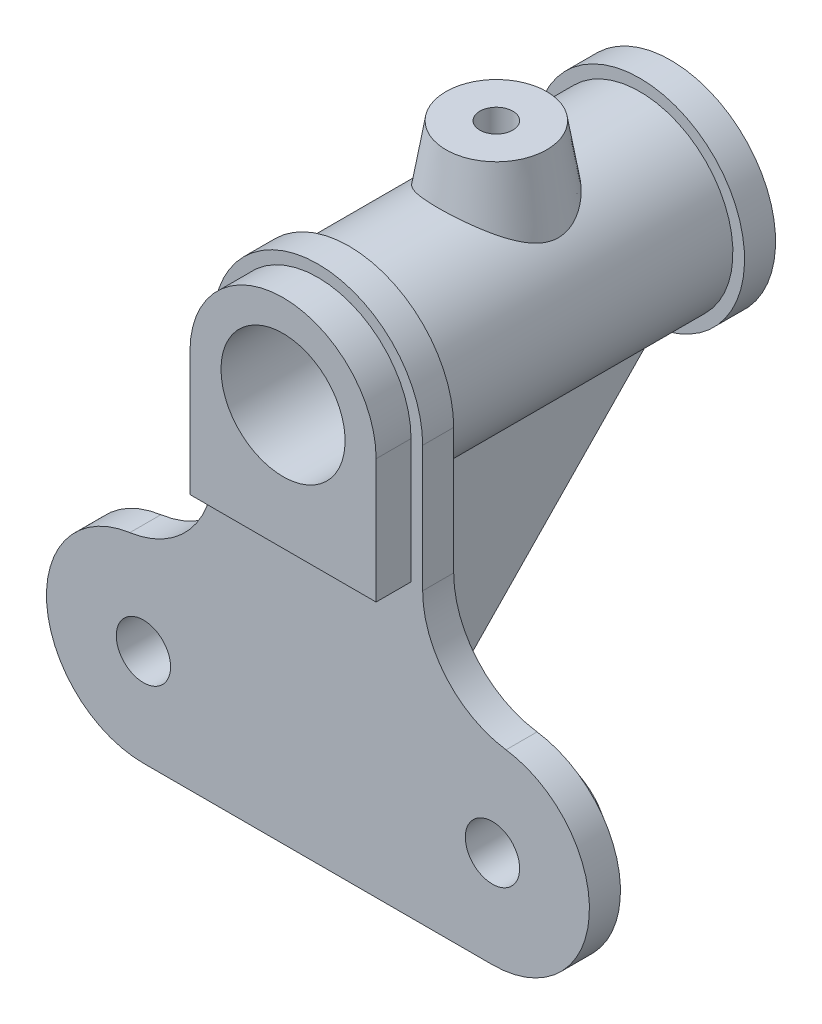
from build123d import *
from build123d.topology import SkipClean

# Parameters (mm, degrees)
SKETCH_1_R               = 7
EXTRUDE_1_DEPTH          = 8
FILLET_1_R               = 25
EXTRUDE_2_DEPTH          = 9
EXTRUDE_START            = 75
SKETCH_3_R               = 24
EXTRUDE_3_DEPTH          = 75
EXTRUDE_START_2          = 8
SKETCH_4_R               = 27
EXTRUDE_4_DEPTH          = 8
SKETCH_5_R               = 7
EXTRUDE_5_DEPTH          = 8
RIB_1_REACH              = 155.851
SKETCH_6_WALL_W          = 405.87807426
SKETCH_6_WALL_H          = 8
SKETCH_8_R               = 16
CUT_EXTRUDE_1_DEPTH      = 170.776323548
HOLE_WIZARD_M10_1_REACH  = 181.549
HOLE_WIZARD_M10_1_BORE_R = 4.25


with BuildPart() as part:
    # 草图1 → 凸台-拉伸1 (new body)
    with BuildSketch(Plane.XY):
        with BuildLine():
            Line((-45, -25), (45, -25))
            ThreePointArc((45, -25), (70, 0), (45, 25))
            Line((45, 25), (27, 25))
            Line((27, 25), (27, 82))
            ThreePointArc((27, 82), (0, 109), (-27, 82))
            Line((-27, 82), (-27, 25))
            Line((-27, 25), (-45, 25))
            ThreePointArc((-45, 25), (-70, 0), (-45, -25))
        make_face()
        with Locations((-45, 0)):
            Circle(SKETCH_1_R, mode=Mode.SUBTRACT)
        with Locations((45, 0)):
            Circle(SKETCH_1_R, mode=Mode.SUBTRACT)
    extrude(amount=EXTRUDE_1_DEPTH)

    # 圆角1
    fillet_1_edges = [part.edges().sort_by_distance(p)[0] for p in [
        (-27, 25, 4),
        (27, 25, 4),
    ]]
    fillet(fillet_1_edges, radius=FILLET_1_R)

    # 草图2 → 凸台-拉伸2 (add)
    with BuildSketch(Plane.XY.offset(8)):
        with BuildLine():
            Line((-24, 82), (-24, 50))
            Line((-24, 50), (24, 50))
            Line((24, 50), (24, 82))
            ThreePointArc((24, 82), (0, 106), (-24, 82))
        make_face()
    extrude(amount=EXTRUDE_2_DEPTH)

    # 草图3 → 凸台-拉伸3 (add)
    with BuildSketch(Plane(origin=(0, 0, 0), x_dir=(-1, 0, 0), z_dir=(0, 0, -1)).offset(EXTRUDE_START)):
        with Locations(Location((0, 82, 0), (0, 0, 180))):
            Circle(SKETCH_3_R)
    extrude(amount=-EXTRUDE_3_DEPTH)

    # 草图4 → 凸台-拉伸4 (add)
    with BuildSketch(Plane(origin=(0, 0, -75), x_dir=(-1, 0, 0), z_dir=(0, 0, -1)).offset(EXTRUDE_START_2)):
        with Locations((0, 82)):
            Circle(SKETCH_4_R)
    extrude(amount=-EXTRUDE_4_DEPTH)

    # 草图5 → 凸台-拉伸5 (add)
    with SkipClean():  # the faces are left unmerged after this step: merging them gives an invalid solid
        with BuildSketch(Plane(origin=(0, 0, 0), x_dir=(-1, 0, 0), z_dir=(0, 0, -1)).offset(EXTRUDE_START_2)):
            with BuildLine():
                Line((-45, 14), (45, 14))
                ThreePointArc((45, 14), (59, 0), (45, -14))
                Line((45, -14), (-45, -14))
                ThreePointArc((-45, -14), (-59, 0), (-45, 14))
            make_face()
            with Locations((45, 0)):
                Circle(SKETCH_5_R, mode=Mode.SUBTRACT)
            with Locations((-45, 0)):
                Circle(SKETCH_5_R, mode=Mode.SUBTRACT)
        extrude(amount=-EXTRUDE_5_DEPTH)

    # 草图6 wall → 筋1 (add, up to next)
    with BuildSketch(Plane(origin=(0, 20.5, -41.5), x_dir=(0, -0.717427837976, 0.696632828179), z_dir=(0, -0.696632828179, -0.717427837976)), mode=Mode.PRIVATE) as rib_1_sk1:
        Rectangle(SKETCH_6_WALL_W, SKETCH_6_WALL_H)
    rib_1_tool1 = extrude(rib_1_sk1.sketch, amount=-RIB_1_REACH, mode=Mode.PRIVATE) - part.part
    add(rib_1_tool1.solids().sort_by_distance((0, 20.5, -41.5))[0])

    # 草图7 → 旋转1 (revolve)
    with BuildSketch(Plane(origin=(0, 0, 0), x_dir=(0, 0, -1), z_dir=(1, 0, 0))):
        Polygon((38, 106), (38, 118), (51, 118), (54.333333333, 98), (38, 98), align=None)
    revolve(axis=Axis((0, 106, -38), (0, 1, 0)))

    # 草图8 → 切除-拉伸1 (cut, through all)
    with BuildSketch(Plane(origin=(0, 0, -83), x_dir=(-1, 0, 0), z_dir=(0, 0, -1))):
        with Locations((0, 82)):
            Circle(SKETCH_8_R)
    extrude(amount=-CUT_EXTRUDE_1_DEPTH, mode=Mode.SUBTRACT)

    # M10 螺纹孔1 bore → M10 螺纹孔1 (cut, up to next)
    with BuildSketch(Plane(origin=(0, 118, 0), x_dir=(1, 0, 0), z_dir=(0, 1, 0)), mode=Mode.PRIVATE) as hole_wizard_m10_1_sk1:
        with Locations((0, 38)):
            Circle(HOLE_WIZARD_M10_1_BORE_R)
    hole_wizard_m10_1_tool1 = extrude(hole_wizard_m10_1_sk1.sketch, amount=-HOLE_WIZARD_M10_1_REACH, mode=Mode.PRIVATE) & part.part
    add(hole_wizard_m10_1_tool1.solids().sort_by_distance((0, 118, -38))[0], mode=Mode.SUBTRACT)


solid = part.part
